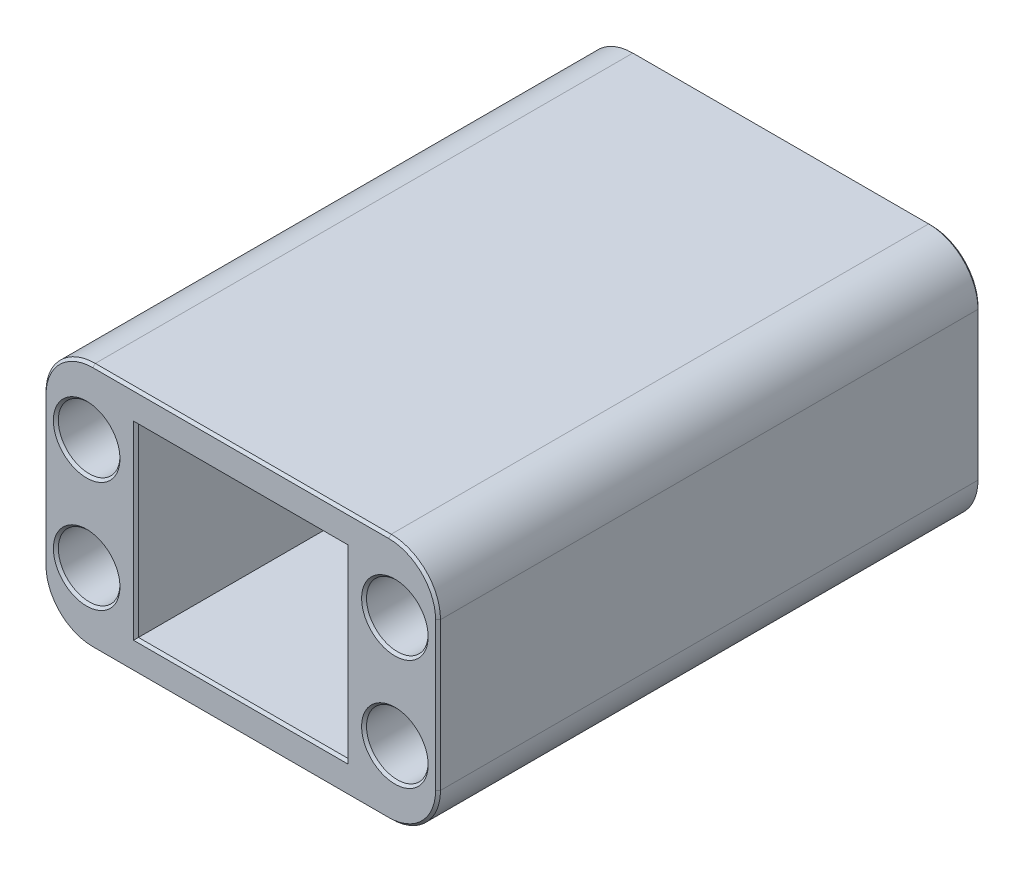
from build123d import *

# Parameters (mm, degrees)
SKETCH1_W           = 40.64
SKETCH1_H           = 25.4
SKETCH1_R           = 3.175
SKETCH1_W_2         = 21.59
SKETCH1_H_2         = 19.05
BOSS_EXTRUDE1_DEPTH = 55.88
FILLET1_R           = 5.08
CHAMFER1_SIZE       = 0.254


with BuildPart() as part:
    # Sketch1 → Boss-Extrude1 (new body)
    with BuildSketch(Plane.XY):
        Rectangle(SKETCH1_W, SKETCH1_H)
        with Locations((-15.875, 5.715)):
            Circle(SKETCH1_R, mode=Mode.SUBTRACT)
        with Locations((15.875, 5.715)):
            Circle(SKETCH1_R, mode=Mode.SUBTRACT)
        with Locations((15.875, -5.715)):
            Circle(SKETCH1_R, mode=Mode.SUBTRACT)
        with Locations((-15.875, -5.715)):
            Circle(SKETCH1_R, mode=Mode.SUBTRACT)
        Rectangle(SKETCH1_W_2, SKETCH1_H_2, mode=Mode.SUBTRACT)
    extrude(amount=BOSS_EXTRUDE1_DEPTH)

    # Fillet1
    fillet1_edges = [part.edges().sort_by_distance(p)[0] for p in [
        (20.32, -12.7, 27.94),
        (-20.32, -12.7, 27.94),
        (-20.32, 12.7, 27.94),
        (20.32, 12.7, 27.94),
    ]]
    fillet(fillet1_edges, radius=FILLET1_R)

    # Chamfer1
    chamfer1_edges = [part.edges().sort_by_distance(p)[0] for p in [
        (-19.05, 5.715, 0),
        (-19.05, 5.715, 55.88),
        (12.7, 5.715, 0),
        (12.7, 5.715, 55.88),
        (12.7, -5.715, 0),
        (12.7, -5.715, 55.88),
        (-19.05, -5.715, 0),
        (-19.05, -5.715, 55.88),
        (10.795, 0, 0),
        (0, 9.525, 0),
        (-10.795, 0, 0),
        (0, -9.525, 0),
        (10.795, 0, 55.88),
        (0, 9.525, 55.88),
        (-10.795, 0, 55.88),
        (0, -9.525, 55.88),
        (0, -12.7, 0),
        (0, -12.7, 55.88),
        (20.32, 0, 0),
        (-20.32, 0, 0),
        (0, 12.7, 0),
        (-18.832102448, 11.212102448, 0),
        (18.832102448, 11.212102448, 0),
        (18.832102448, -11.212102448, 0),
        (-18.832102448, -11.212102448, 0),
        (-20.32, 0, 55.88),
        (20.32, 0, 55.88),
        (0, 12.7, 55.88),
        (-18.832102448, 11.212102448, 55.88),
        (18.832102448, 11.212102448, 55.88),
        (18.832102448, -11.212102448, 55.88),
        (-18.832102448, -11.212102448, 55.88),
    ]]
    chamfer(chamfer1_edges, length=CHAMFER1_SIZE)


solid = part.part
